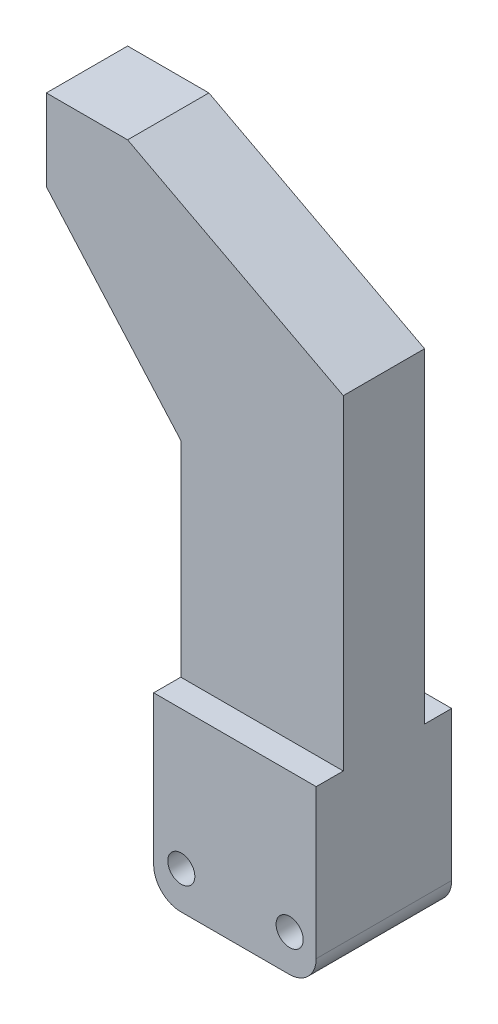
from build123d import *

# Parameters (mm, degrees)
EXTRUDE_1_DEPTH     = 9
EXTRUDE_2_DEPTH     = 36
SKETCH_3_W          = 36
SKETCH_3_H          = 39
EXTRUDE_4_DEPTH     = 15
SKETCH_5_R          = 3
CUT_EXTRUDE_1_DEPTH = 122.11819461
FILLET_1_R          = 6


with BuildPart() as part:
    # 草图1 → 凸台-拉伸1 (new, symmetric)
    with BuildSketch(Plane.XY):
        Polygon((0, 0), (0, 72), (-47.770032799, 97.179832534), (-65.770032799, 97.179832534), (-65.770032799, 79.179832534), (-36, 45.434534385), (-36, 0), align=None)
    extrude(amount=EXTRUDE_1_DEPTH, both=True)

    # 草图2 → 凸台-拉伸2 (add)
    with BuildSketch(Plane(origin=(0, 0, 0), x_dir=(0, 0, -1), z_dir=(1, 0, 0))):
        Polygon((-3.6, 0), (-8.977776638, -6), (9.022223362, -6), (3.6, 0), align=None)
    extrude(amount=-EXTRUDE_2_DEPTH)

    # 草图3 → 凸台-拉伸4 (add, symmetric)
    with BuildSketch(Plane.XY):
        with Locations((-18, -19.5)):
            Rectangle(SKETCH_3_W, SKETCH_3_H)
    extrude(amount=EXTRUDE_4_DEPTH, both=True)

    # 草图5 → 切除-拉伸1 (cut, through all)
    with BuildSketch(Plane.XY.offset(15)):
        with Locations((-29.881296057, -30.673800583)):
            Circle(SKETCH_5_R)
        with Locations((-5.88176625, -30.824030402)):
            Circle(SKETCH_5_R)
    extrude(amount=-CUT_EXTRUDE_1_DEPTH, mode=Mode.SUBTRACT)

    # 圆角1
    fillet_1_edges = [part.edges().sort_by_distance(p)[0] for p in [
        (-36, -39, 0),
        (0, -39, 0),
    ]]
    fillet(fillet_1_edges, radius=FILLET_1_R)


solid = part.part
